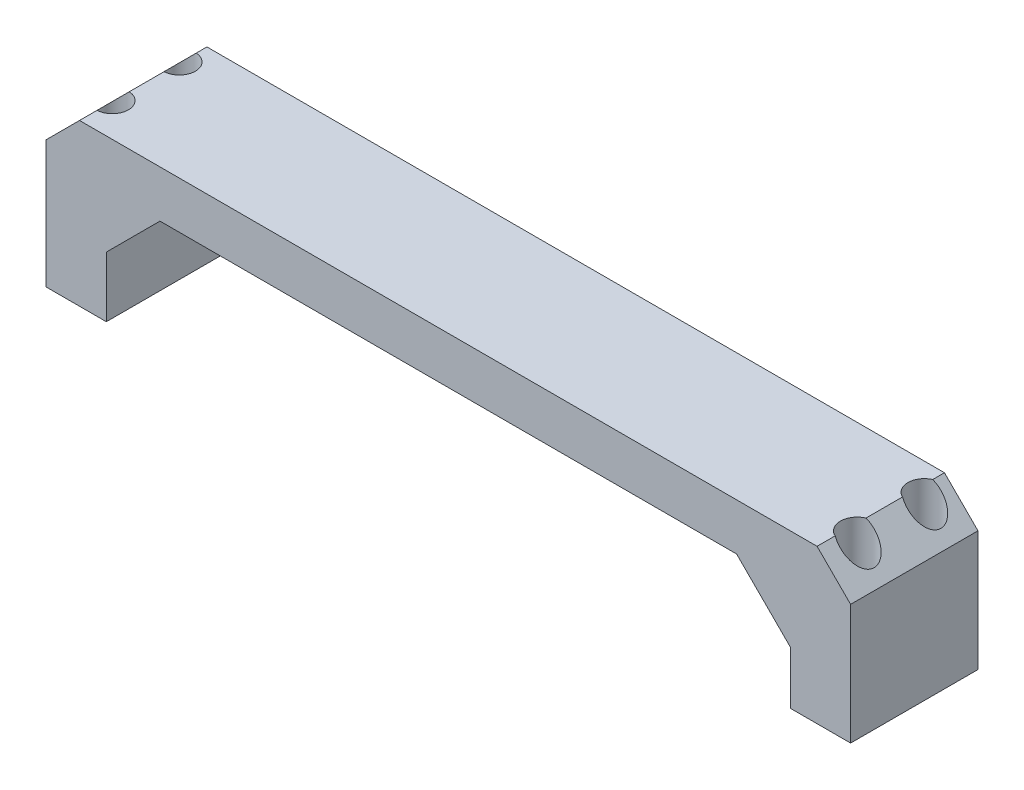
from build123d import *

# Parameters (mm, degrees)
BOSS_EXTRUDE1_DEPTH      = 13.97
BOSS_EXTRUDE1_DEPTH_BACK = 10.16
CHAMFER1_SIZE            = 6.35
SKETCH2_R                = 3.048
SKETCH2_R_2              = 3.190843713
SKETCH2_R_3              = 3.125749827
CUT_EXTRUDE1_DEPTH       = 88.976767749
CHAMFER2_SIZE            = 3.81


with BuildPart() as part:
    # Sketch1 → Boss-Extrude1 (new, two sides: drawn at the far end of the back side and taken through both)
    with BuildSketch(Plane.XY.offset(-BOSS_EXTRUDE1_DEPTH_BACK)):
        Polygon((81.337078652, 12.7), (-71.062921348, 12.7), (-71.062921348, -17.78), (-59.632921348, -17.78), (-59.632921348, 0), (69.907078652, 0), (69.907078652, -16.41011236), (81.337078652, -16.41011236), align=None)
    extrude(amount=BOSS_EXTRUDE1_DEPTH + BOSS_EXTRUDE1_DEPTH_BACK)

    # Chamfer1
    chamfer1_edges = [part.edges().sort_by_distance(p)[0] for p in [
        (69.907078652, 0, 1.905),
        (-59.632921348, 0, 1.905),
        (-71.062921348, 12.7, 1.905),
        (81.337078652, 12.7, 1.905),
    ]]
    chamfer(chamfer1_edges, length=CHAMFER1_SIZE)

    # Sketch2 → Cut-Extrude1 (cut, through all)
    with BuildSketch(Plane.XZ.offset(17.78)):
        with Locations((-64.865321348, 7.605218814)):
            Circle(SKETCH2_R)
        with Locations((-64.865321348, -5.08)):
            Circle(SKETCH2_R)
        with Locations((76.257078652, 7.62)):
            Circle(SKETCH2_R_2)
        with Locations((76.257078652, -5.08)):
            Circle(SKETCH2_R_3)
    extrude(amount=-CUT_EXTRUDE1_DEPTH, mode=Mode.SUBTRACT)

    # Chamfer2
    chamfer2_edges = [part.edges().sort_by_distance(p)[0] for p in [
        (5.137078652, 0, -10.16),
        (5.137078652, 0, 13.97),
    ]]
    chamfer(chamfer2_edges, length=CHAMFER2_SIZE)


solid = part.part
